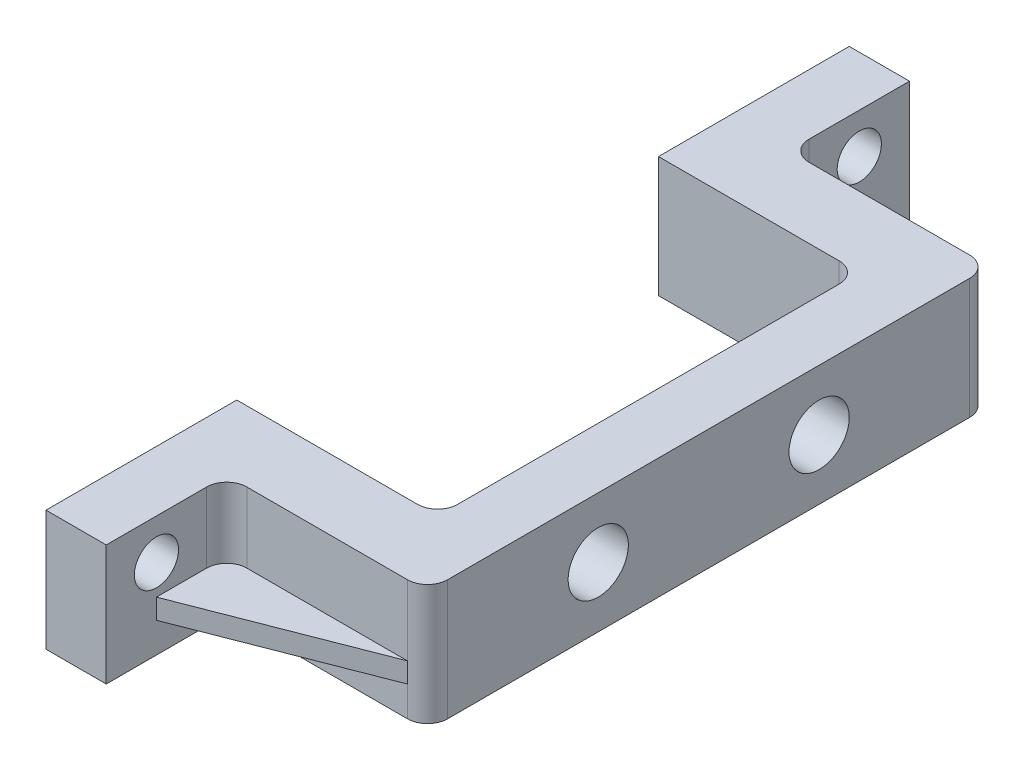
from build123d import *

# Parameters (mm, degrees)
SKETCH1_W             = 6
SKETCH1_H             = 9.5
BOSS_EXTRUDE1_DEPTH   = 10
BOSS_EXTRUDE1_2_DEPTH = 10
SKETCH2_W             = 6
SKETCH2_H             = 6
CUT_EXTRUDE1_DEPTH    = 7
SKETCH3_W             = 28
SKETCH3_H             = 6
BOSS_EXTRUDE2_DEPTH   = 3
SKETCH4_R             = 1.5
CUT_EXTRUDE2_DEPTH    = 3
FILLET1_R             = 1
BOSS_EXTRUDE3_DEPTH   = 0.5
SKETCH6_R             = 1.1
CUT_EXTRUDE3_DEPTH    = 3


with BuildPart() as part:
    # Sketch1 → Boss-Extrude1 (new body)
    with BuildSketch(Plane.YZ):
        with Locations((233.5, -17.805567315)):
            Rectangle(SKETCH1_W, SKETCH1_H)
    extrude(amount=BOSS_EXTRUDE1_DEPTH)


with BuildPart() as body_2:
    # Sketch1 → Boss-Extrude1 2 (new body)
    with BuildSketch(Plane.YZ):
        with Locations((233.5, 12.694432685)):
            Rectangle(SKETCH1_W, SKETCH1_H)
    extrude(amount=BOSS_EXTRUDE1_2_DEPTH)


with BuildPart() as cut_extrude1_tool:
    # Sketch2 → Cut-Extrude1 (new body)
    with BuildSketch(Plane(origin=(10, 0, 0), x_dir=(0, 0, -1), z_dir=(1, 0, 0))):
        with Locations((-14.444432685, 233.5)):
            Rectangle(SKETCH2_W, SKETCH2_H)
        with Locations((19.555567315, 233.5)):
            Rectangle(SKETCH2_W, SKETCH2_H)
    extrude(amount=-CUT_EXTRUDE1_DEPTH)


with BuildPart() as part_1:
    add(part.part)

    # Cut-Extrude1: cut by cut_extrude1_tool
    add(cut_extrude1_tool.part, mode=Mode.SUBTRACT)



with BuildPart() as body_2_1:
    add(body_2.part)

    # Cut-Extrude1: cut by cut_extrude1_tool
    add(cut_extrude1_tool.part, mode=Mode.SUBTRACT)


with BuildPart() as part_2:
    add(part_1.part)

    add(body_2_1.part)  # Boss-Extrude2 merges body 2
    # Sketch3 → Boss-Extrude2 (add)
    with BuildSketch(Plane(origin=(10, 0, 0), x_dir=(0, 0, -1), z_dir=(1, 0, 0))):
        with Locations((2.555567315, 233.5)):
            Rectangle(SKETCH3_W, SKETCH3_H)
    extrude(amount=BOSS_EXTRUDE2_DEPTH)

    # Sketch4 → Cut-Extrude2 (cut)
    with BuildSketch(Plane.ZY.offset(-10)):
        with Locations((-8.055567315, 233.5)):
            Circle(SKETCH4_R)
        with Locations((2.944432685, 233.5)):
            Circle(SKETCH4_R)
    extrude(amount=-CUT_EXTRUDE2_DEPTH, mode=Mode.SUBTRACT)

    # Fillet1
    fillet1_edges = [part_2.edges().sort_by_distance(p)[0] for p in [
        (10, 233.5, -13.055567315),
        (3, 233.5, -16.555567315),
        (13, 233.5, 11.444432685),
        (13, 233.5, -16.555567315),
        (10, 233.5, 7.944432685),
        (3, 233.5, 11.444432685),
    ]]
    fillet(fillet1_edges, radius=FILLET1_R)

    # Sketch5 → Boss-Extrude3 (add, symmetric)
    with BuildSketch(Plane(origin=(0, 232.5, 0), x_dir=(-1, 0, 0), z_dir=(0, -1, 0))):
        Polygon((-12, 16.555567315), (-3, 20.055567315), (-3, 16.555567315), align=None)
        Polygon((-12, -11.444432685), (-3, -14.944432685), (-3, -11.444432685), align=None)
    extrude(amount=BOSS_EXTRUDE3_DEPTH, both=True)

    # Sketch6 → Cut-Extrude3 (cut)
    with BuildSketch(Plane(origin=(3, 0, 0), x_dir=(0, 0, -1), z_dir=(1, 0, 0))):
        with Locations((20.055567315, 234.5)):
            Circle(SKETCH6_R)
        with Locations((-14.944432685, 234.5)):
            Circle(SKETCH6_R)
    extrude(amount=-CUT_EXTRUDE3_DEPTH, mode=Mode.SUBTRACT)


solid = part_2.part
